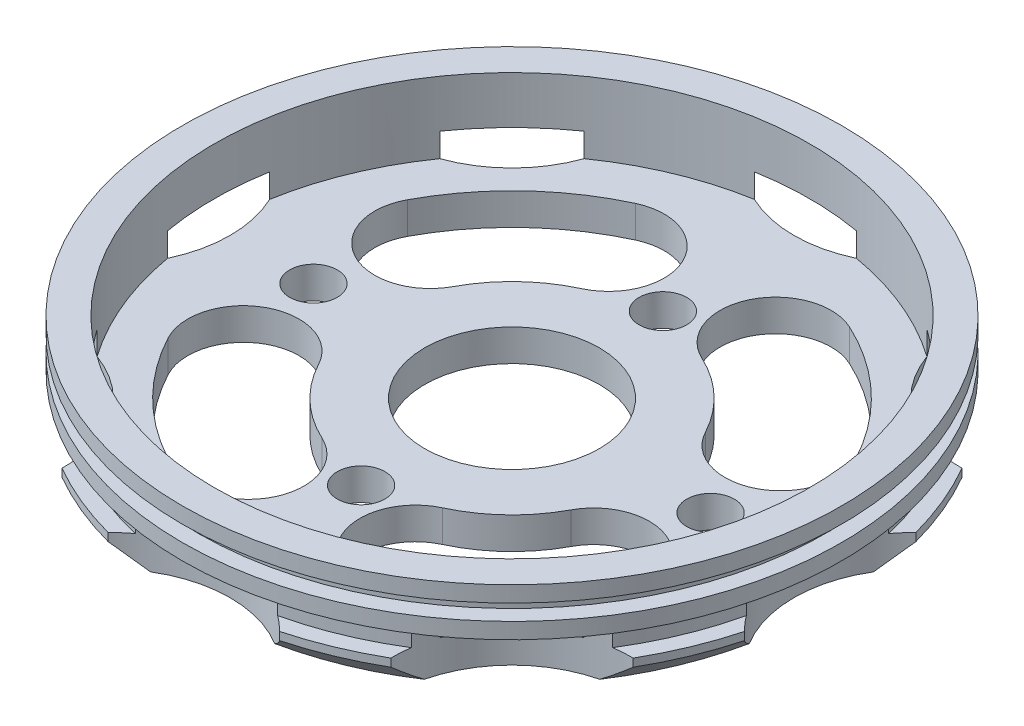
from build123d import *

# Parameters (mm, degrees)
SKETCH1_R           = 20.75
BOSS_EXTRUDE1_DEPTH = 6.5
CUT_EXTRUDE1_START  = -1
SKETCH2_R           = 20.75
SKETCH2_R_2         = 19.75
CUT_EXTRUDE1_DEPTH  = 1
CUT_EXTRUDE2_START  = -1.5
SKETCH3_R           = 20.75
SKETCH3_R_2         = 19.75
CUT_EXTRUDE2_DEPTH  = 1.5
CHAMFER1_SIZE       = 1.5
SKETCH4_R           = 18.75
CUT_EXTRUDE3_DEPTH  = 4.5
CUT_EXTRUDE4_DEPTH  = 3.5
CIRPATTERN1_COUNT   = 8
SKETCH6_R           = 1.5
SKETCH6_R_2         = 5.5
CUT_EXTRUDE5_DEPTH  = 3.5


with BuildPart() as part:
    # Sketch1 → Boss-Extrude1 (new body)
    with BuildSketch(Plane(origin=(0, 0, 0), x_dir=(1, 0, 0), z_dir=(0, 1, 0))):
        Circle(SKETCH1_R)
    extrude(amount=BOSS_EXTRUDE1_DEPTH)

    # Sketch2 → Cut-Extrude1 (cut)
    with BuildSketch(Plane(origin=(0, 5.5, 0), x_dir=(1, 0, 0), z_dir=(0, 1, 0)).offset(CUT_EXTRUDE1_START)):
        Circle(SKETCH2_R)
        Circle(SKETCH2_R_2, mode=Mode.SUBTRACT)
    extrude(amount=CUT_EXTRUDE1_DEPTH, mode=Mode.SUBTRACT)

    # Sketch3 → Cut-Extrude2 (cut)
    with BuildSketch(Plane(origin=(0, 3.5, 0), x_dir=(1, 0, 0), z_dir=(0, 1, 0)).offset(CUT_EXTRUDE2_START)):
        Circle(SKETCH3_R)
        Circle(SKETCH3_R_2, mode=Mode.SUBTRACT)
    extrude(amount=CUT_EXTRUDE2_DEPTH, mode=Mode.SUBTRACT)

    # Chamfer1
    chamfer1_edges = [part.edges().sort_by_distance(p)[0] for p in [
        (-20.75, 0, 0),
    ]]
    chamfer(chamfer1_edges, length=CHAMFER1_SIZE)

    # Sketch4 → Cut-Extrude3 (cut)
    with BuildSketch(Plane(origin=(0, 6.5, 0), x_dir=(1, 0, 0), z_dir=(0, 1, 0))):
        Circle(SKETCH4_R)
    extrude(amount=-CUT_EXTRUDE3_DEPTH, mode=Mode.SUBTRACT)

    # Sketch5 → Cut-Extrude4 (cut)
    with BuildSketch(Plane.XZ):
        with BuildLine():
            ThreePointArc((6, -20.75), (0, -17.750879894), (-6, -20.75))
            ThreePointArc((-6, -20.75), (0, -23.235281374), (6, -20.75))
        make_face()
    cut_extrude4 = extrude(amount=-CUT_EXTRUDE4_DEPTH, mode=Mode.SUBTRACT)

    # CirPattern1: Cut-Extrude4 ×8 about axis
    cirpattern1_axis = Axis((0, 6.5, 0), (0, -1, 0))
    for i in range(1, CIRPATTERN1_COUNT):
        add(cut_extrude4.rotate(cirpattern1_axis, i * 360 / CIRPATTERN1_COUNT), mode=Mode.SUBTRACT)

    # Sketch6 → Cut-Extrude5 (cut)
    with BuildSketch(Plane(origin=(0, 0, 0), x_dir=(-1, 0, 0), z_dir=(0, -1, 0))):
        with Locations((0, 9.5)):
            Circle(SKETCH6_R)
        with Locations((-12.5, 0)):
            Circle(SKETCH6_R)
        with BuildLine():
            ThreePointArc((-14.117584779, 7.529528538), (-12.676447476, 2.7942225), (-7.941141438, 4.235359803))
            ThreePointArc((-7.941141438, 4.235359803), (-6.184060598, 6.538913863), (-3.786151182, 8.164867374))
            ThreePointArc((-3.786151182, 8.164867374), (-2.083317107, 12.812485701), (-6.730935434, 14.515319775))
            ThreePointArc((-6.730935434, 14.515319775), (-10.993885508, 11.624735757), (-14.117584779, 7.529528538))
        make_face()
        with Locations((12.5, 0)):
            Circle(SKETCH6_R)
        with Locations((0, -9.5)):
            Circle(SKETCH6_R)
        with BuildLine():
            ThreePointArc((7.941141438, 4.235359803), (12.676447476, 2.7942225), (14.117584779, 7.529528538))
            ThreePointArc((14.117584779, 7.529528538), (10.993885508, 11.624735757), (6.730935434, 14.515319775))
            ThreePointArc((6.730935434, 14.515319775), (2.083317107, 12.812485701), (3.786151182, 8.164867374))
            ThreePointArc((3.786151182, 8.164867374), (6.184060598, 6.538913863), (7.941141438, 4.235359803))
        make_face()
        with BuildLine():
            ThreePointArc((7.941141438, -4.235359803), (6.184060598, -6.538913863), (3.786151182, -8.164867374))
            ThreePointArc((3.786151182, -8.164867374), (2.083317107, -12.812485701), (6.730935434, -14.515319775))
            ThreePointArc((6.730935434, -14.515319775), (10.993885508, -11.624735757), (14.117584779, -7.529528538))
            ThreePointArc((14.117584779, -7.529528538), (12.676447476, -2.7942225), (7.941141438, -4.235359803))
        make_face()
        with BuildLine():
            ThreePointArc((-6.730935434, -14.515319775), (-2.083317107, -12.812485701), (-3.786151182, -8.164867374))
            ThreePointArc((-3.786151182, -8.164867374), (-6.184060598, -6.538913863), (-7.941141438, -4.235359803))
            ThreePointArc((-7.941141438, -4.235359803), (-12.676447476, -2.7942225), (-14.117584779, -7.529528538))
            ThreePointArc((-14.117584779, -7.529528538), (-10.993885508, -11.624735757), (-6.730935434, -14.515319775))
        make_face()
        Circle(SKETCH6_R_2)
    extrude(amount=-CUT_EXTRUDE5_DEPTH, mode=Mode.SUBTRACT)


solid = part.part
